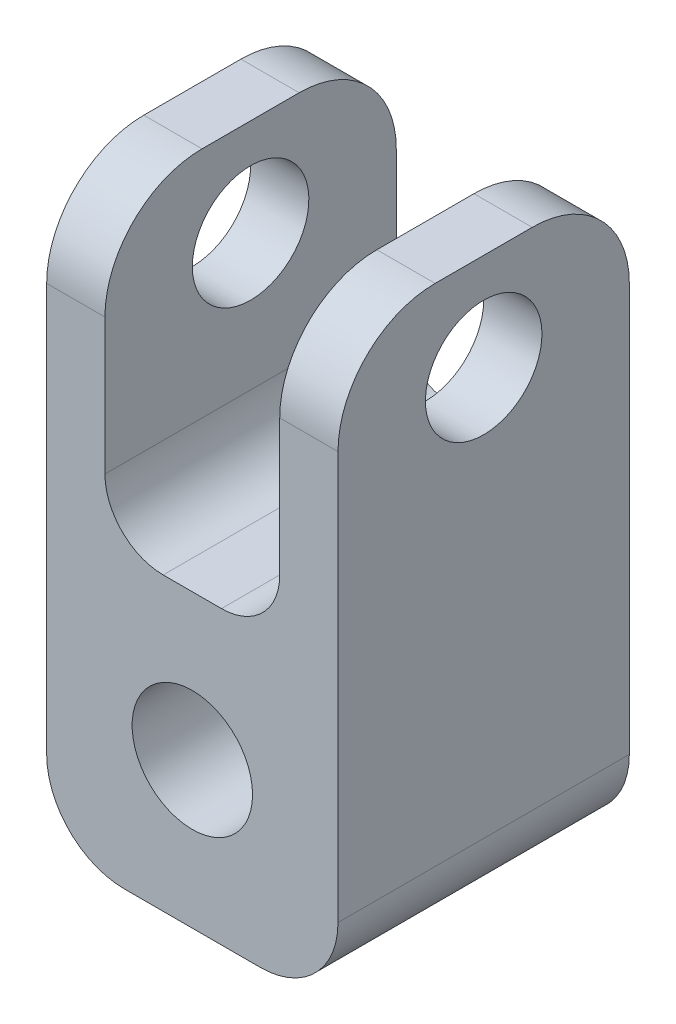
from build123d import *

# Parameters (mm, degrees)
SKETCH2_W           = 30
SKETCH2_H           = 30
SKETCH2_R           = 6.2
BOSS_EXTRUDE2_DEPTH = 30
SKETCH4_W           = 6
SKETCH4_H           = 30
BOSS_EXTRUDE3_DEPTH = 30
FILLET1_R           = 8
FILLET4_R           = 10
SKETCH5_R           = 6
CUT_EXTRUDE1_DEPTH  = 30
FILLET5_R           = 6


with BuildPart() as part:
    # Sketch2 → Boss-Extrude2 (new body)
    with BuildSketch(Plane.XY):
        Rectangle(SKETCH2_W, SKETCH2_H)
        Circle(SKETCH2_R, mode=Mode.SUBTRACT)
    extrude(amount=BOSS_EXTRUDE2_DEPTH)

    # Sketch4 → Boss-Extrude3 (add)
    with BuildSketch(Plane(origin=(0, 15, 0), x_dir=(1, 0, 0), z_dir=(0, 1, 0))):
        with Locations((-12, -15)):
            Rectangle(SKETCH4_W, SKETCH4_H)
        with Locations((12, -15)):
            Rectangle(SKETCH4_W, SKETCH4_H)
    extrude(amount=BOSS_EXTRUDE3_DEPTH)

    # Fillet1
    fillet1_edges = [part.edges().sort_by_distance(p)[0] for p in [
        (15, -15, 15),
        (-15, -15, 15),
    ]]
    fillet(fillet1_edges, radius=FILLET1_R)

    # Fillet4
    fillet4_edges = [part.edges().sort_by_distance(p)[0] for p in [
        (-12, 45, 30),
        (-12, 45, 0),
        (12, 45, 30),
        (12, 45, 0),
    ]]
    fillet(fillet4_edges, radius=FILLET4_R)

    # Sketch5 → Cut-Extrude1 (cut)
    with BuildSketch(Plane.ZY.offset(15)):
        with Locations(Location((15, 35, 0), (0, 0, 270))):
            Circle(SKETCH5_R)
    extrude(amount=-CUT_EXTRUDE1_DEPTH, mode=Mode.SUBTRACT)

    # Fillet5
    fillet5_edges = [part.edges().sort_by_distance(p)[0] for p in [
        (-9, 15, 15),
        (9, 15, 15),
    ]]
    fillet(fillet5_edges, radius=FILLET5_R)


solid = part.part
